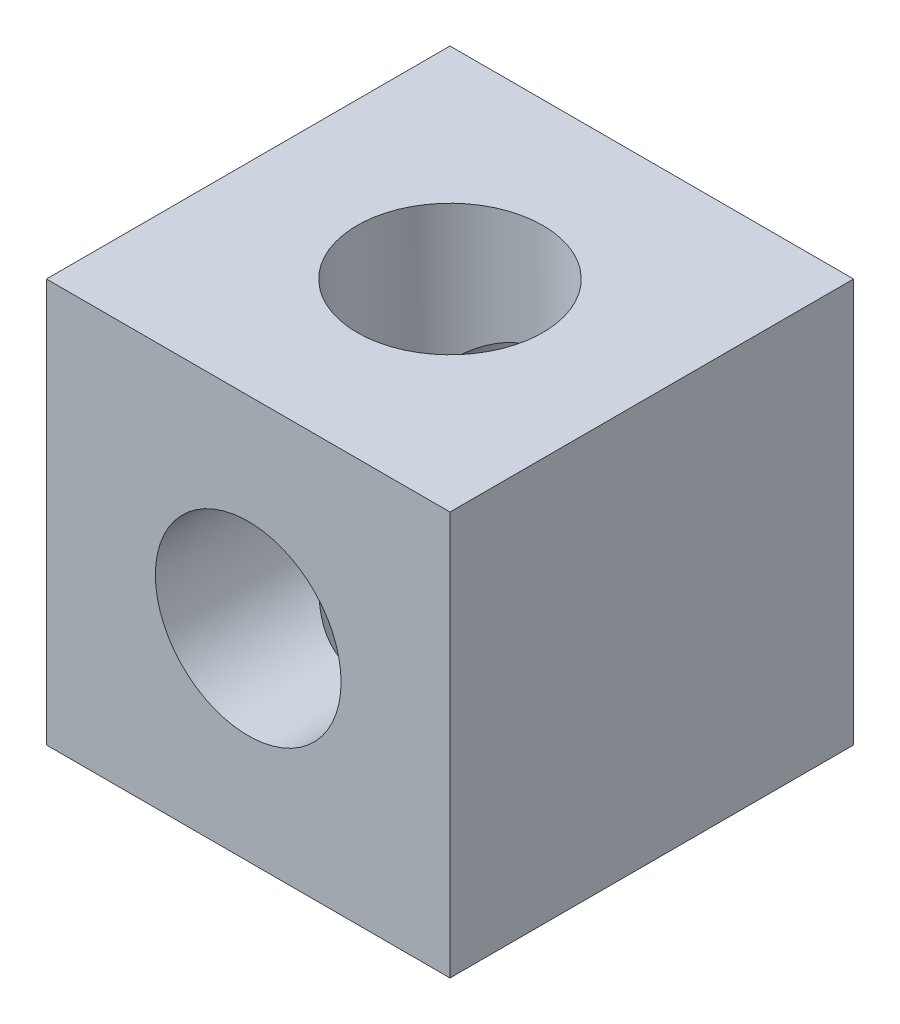
from build123d import *

# Parameters (mm, degrees)
SKETCH1_W           = 20.32
SKETCH1_H           = 20.32
BOSS_EXTRUDE1_DEPTH = 10.16
CUT_EXTRUDE1_REACH  = 26.887
SKETCH2_R           = 4.675
SKETCH3_R           = 4.675
CUT_EXTRUDE2_DEPTH  = 25.886815787


with BuildPart() as part:
    # Sketch1 → Boss-Extrude1 (new, symmetric)
    with BuildSketch(Plane(origin=(0, 0, 0), x_dir=(1, 0, 0), z_dir=(0, 1, 0))):
        Rectangle(SKETCH1_W, SKETCH1_H)
    extrude(amount=BOSS_EXTRUDE1_DEPTH, both=True)

    # Sketch2 → Cut-Extrude1 (cut, up to next)
    with BuildSketch(Plane.XY.offset(10.16), mode=Mode.PRIVATE) as cut_extrude1_sk1:
        Circle(SKETCH2_R)
    cut_extrude1_tool1 = extrude(cut_extrude1_sk1.sketch, amount=-CUT_EXTRUDE1_REACH, mode=Mode.PRIVATE) & part.part
    add(cut_extrude1_tool1.solids().sort_by_distance((0, 0, 10.16))[0], mode=Mode.SUBTRACT)

    # Sketch3 → Cut-Extrude2 (cut, through all)
    with BuildSketch(Plane(origin=(0, 10.16, 0), x_dir=(1, 0, 0), z_dir=(0, 1, 0))):
        with Locations(Location((0, 0, 0), (0, 0, 270))):
            Circle(SKETCH3_R)
    extrude(amount=-CUT_EXTRUDE2_DEPTH, mode=Mode.SUBTRACT)


solid = part.part
